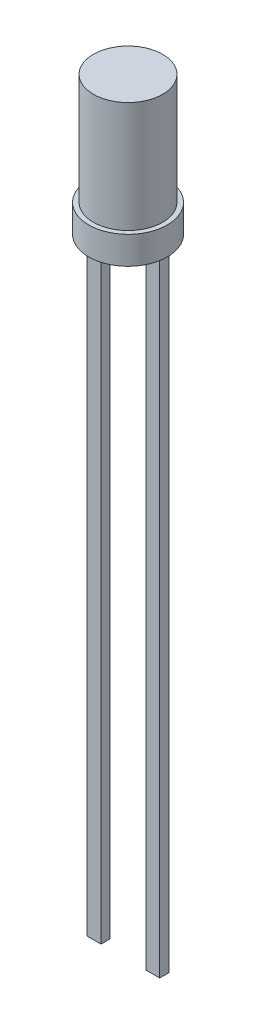
from build123d import *

# Parameters (mm, degrees)
SKETCH1_R           = 1.5
BOSS_EXTRUDE1_DEPTH = 4.8
SKETCH2_R           = 1.7
BOSS_EXTRUDE2_DEPTH = 1.2
SKETCH3_W           = 0.6
SKETCH3_H           = 0.4
BOSS_EXTRUDE3_DEPTH = 27


with BuildPart() as part:
    # Sketch1 → Boss-Extrude1 (new body)
    with BuildSketch(Plane(origin=(0, 0, 0), x_dir=(1, 0, 0), z_dir=(0, 1, 0))):
        with Locations(Location((0, 0, 0), (0, 0, 270))):
            Circle(SKETCH1_R)
    extrude(amount=-BOSS_EXTRUDE1_DEPTH)

    # Sketch2 → Boss-Extrude2 (add)
    with BuildSketch(Plane.XZ.offset(4.8)):
        with Locations(Location((0, 0, 0), (0, 0, 270))):
            Circle(SKETCH2_R)
    extrude(amount=BOSS_EXTRUDE2_DEPTH)

    # Sketch3 → Boss-Extrude3 (add)
    with BuildSketch(Plane.XZ.offset(6)):
        with Locations((-1.27, 0)):
            Rectangle(SKETCH3_W, SKETCH3_H)
        with Locations((1.27, 0)):
            Rectangle(SKETCH3_W, SKETCH3_H)
    extrude(amount=BOSS_EXTRUDE3_DEPTH)


solid = part.part
